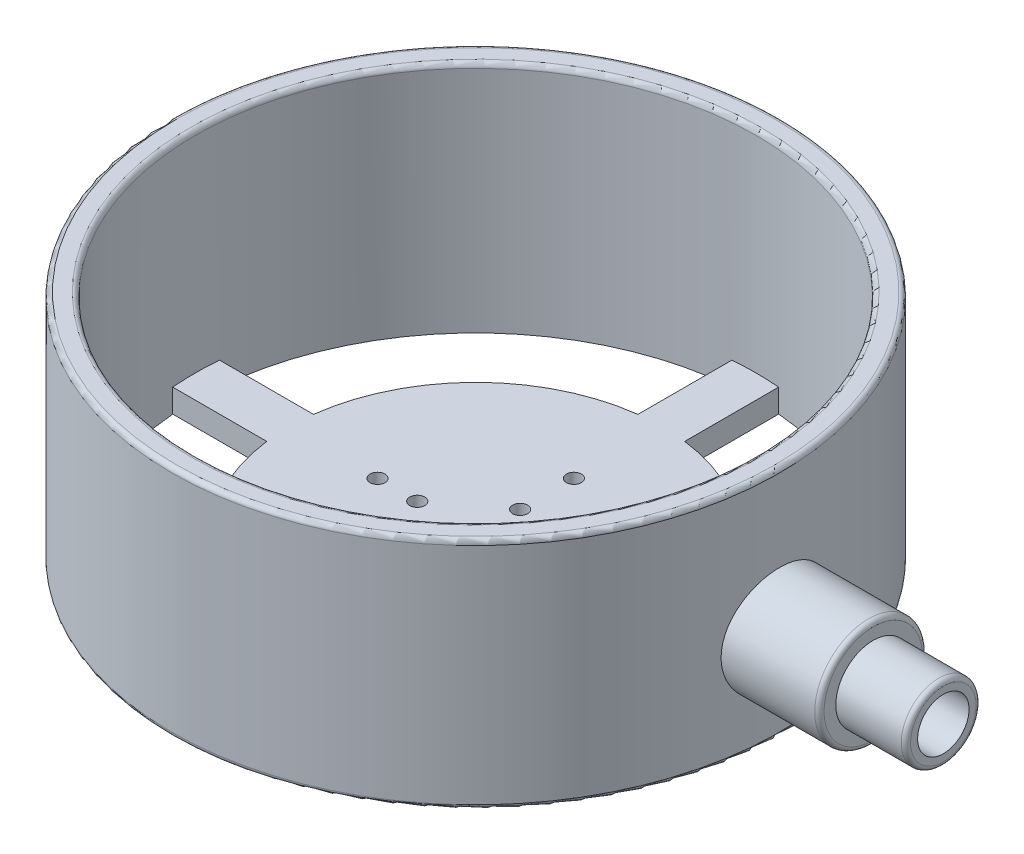
from build123d import *

# Parameters (mm, degrees)
SKETCH1_R           = 65
SKETCH1_R_2         = 60
BOSS_EXTRUDE2_DEPTH = 50
SKETCH2_R           = 40
BOSS_EXTRUDE4_DEPTH = 5
SKETCH15_R          = 1.6
CUT_EXTRUDE7_DEPTH  = 10
CUT_EXTRUDE9_START  = -50
SKETCH16_R          = 5.5
CUT_EXTRUDE9_DEPTH  = 50
FILLET1_R           = 1


with BuildPart() as part:
    # Sketch1 → Boss-Extrude2 (new body)
    with BuildSketch(Plane(origin=(0, 0, 0), x_dir=(1, 0, 0), z_dir=(0, 1, 0))):
        with Locations(Location((0, 0, 0), (0, 0, 270))):
            Circle(SKETCH1_R)
        with Locations(Location((0, 0, 0), (0, 0, 270))):
            Circle(SKETCH1_R_2, mode=Mode.SUBTRACT)
    extrude(amount=BOSS_EXTRUDE2_DEPTH)

    # Sketch2 → Boss-Extrude4 (add)
    with BuildSketch(Plane(origin=(0, 0, 0), x_dir=(-1, 0, 0), z_dir=(0, -1, 0))):
        Circle(SKETCH2_R)
        Polygon((0, -60), (-5, -60), (-5, 60), (0, 60), (5, 60), (5, -60), align=None)
        Polygon((-60, 0), (-60, 5), (60, 5), (60, 0), (60, -5), (-60, -5), align=None)
    extrude(amount=-BOSS_EXTRUDE4_DEPTH)

    # Sketch15 → Cut-Extrude7 (cut)
    with BuildSketch(Plane(origin=(0, 0, 0), x_dir=(-1, 0, 0), z_dir=(0, -1, 0))):
        with Locations(Location((0, -9.5, 0), (0, 0, 90))):
            Circle(SKETCH15_R)
        with Locations(Location((-12.5, 0, 0), (0, 0, 90))):
            Circle(SKETCH15_R)
        with Locations(Location((0, 9.5, 0), (0, 0, 90))):
            Circle(SKETCH15_R)
        with Locations(Location((12.5, 0, 0), (0, 0, 90))):
            Circle(SKETCH15_R)
        with Locations(Location((0, -21, 0), (0, 0, 90))):
            Circle(SKETCH15_R)
        with Locations(Location((-21, 0, 0), (0, 0, 90))):
            Circle(SKETCH15_R)
        with Locations(Location((0, 21, 0), (0, 0, 90))):
            Circle(SKETCH15_R)
        with Locations(Location((21, 0, 0), (0, 0, 90))):
            Circle(SKETCH15_R)
    extrude(amount=-CUT_EXTRUDE7_DEPTH, mode=Mode.SUBTRACT)

    # Sketch9 → Revolve1 (revolve)
    with BuildSketch(Plane.XY, mode=Mode.PRIVATE) as revolve1_sk:
        Polygon((100, 12), (100, 14.5), (63, 14.5), (63, 8.5), (85, 8.5), (85, 12), align=None)
    revolve(revolve1_sk.sketch.rotate(Axis((0, 20, 0), (1, 0, 0)), 270), axis=Axis((0, 20, 0), (1, 0, 0)))

    # Sketch16 → Cut-Extrude9 (cut)
    with BuildSketch(Plane(origin=(100, 0, 0), x_dir=(0, 0, -1), z_dir=(1, 0, 0)).offset(CUT_EXTRUDE9_START)):
        with Locations(Location((0, 20, 0), (0, 0, 180))):
            Circle(SKETCH16_R)
    extrude(amount=CUT_EXTRUDE9_DEPTH, mode=Mode.SUBTRACT)

    # Fillet1
    fillet1_edges = [part.edges().sort_by_distance(p)[0] for p in [
        (85, 20, -11.5),
        (100, 20, -8),
        (0, 0, -65),
        (0, 50, -65),
        (0, 50, -60),
    ]]
    fillet(fillet1_edges, radius=FILLET1_R)


solid = part.part
